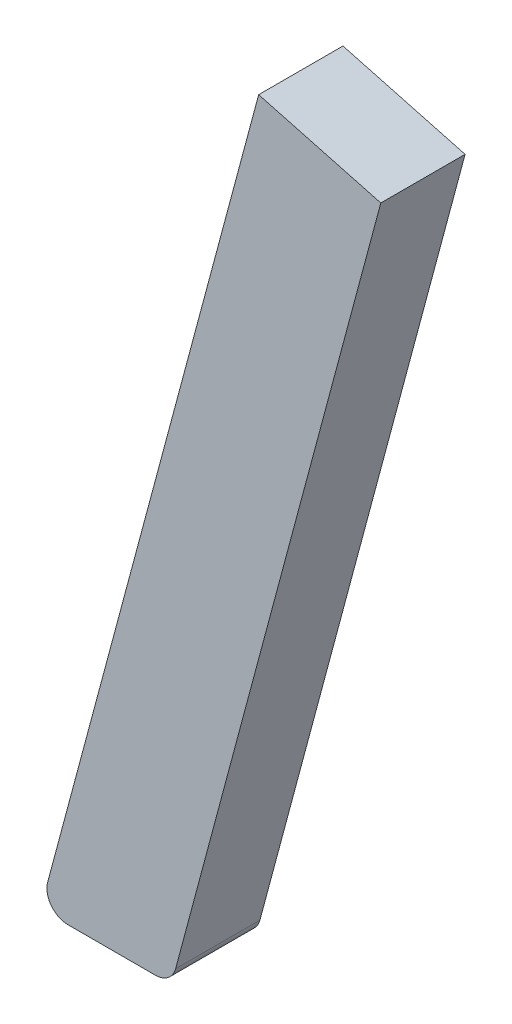
from build123d import *

# Parameters (mm, degrees)
BOSS_EXTRU_1_DEPTH = 20
CONG_1_R           = 5


with BuildPart() as part:
    # Esquisse1 → Boss.-Extru.1 (new body)
    with BuildSketch(Plane.XY):
        Polygon((0, 0), (31.058285412, 0), (80.741583809, 185.420593905), (51.763809021, 193.185165258), align=None)
    extrude(amount=BOSS_EXTRU_1_DEPTH)

    # Congé1
    cong_1_edges = [part.edges().sort_by_distance(p)[0] for p in [
        (31.058285412, 0, 10),
        (0, 0, 10),
    ]]
    fillet(cong_1_edges, radius=CONG_1_R)


solid = part.part
